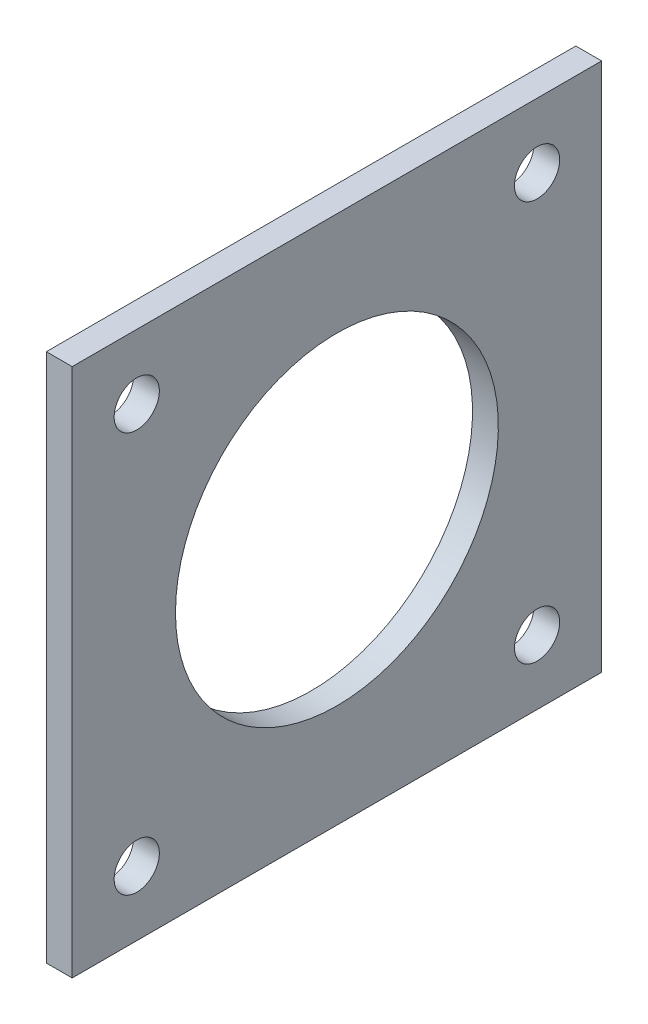
from build123d import *

# Parameters (mm, degrees)
BOSS_EXTRUDE2_DEPTH          = 8
BOSS_EXTRUDE2_DEPTH_BACK     = 1
SKETCH1_R                    = 2.5
CUT_EXTRUDE1_DEPTH           = 79.300702423
CUT_EXTRUDE1_DEPTH_BACK      = 79.300702423
SKETCH2_R                    = 2.5
SKETCH3_R                    = 3.25
CUT_EXTRUDE5_DEPTH           = 15
CUT_EXTRUDE5_DRAFT           = -0.0573
CUT_EXTRUDE5_PROFILE_2_DEPTH = 15
CUT_EXTRUDE5_PROFILE_2_DRAFT = -0.0573
SKETCH5_W                    = 4.5
SKETCH5_H                    = 6.5
BOSS_EXTRUDE3_DEPTH          = 14.5
SKETCH6_R                    = 4
CUT_EXTRUDE4_DEPTH           = 1.5
SKETCH12_W                   = 10.5
SKETCH12_H                   = 30
BOSS_EXTRUDE7_DEPTH          = 9
SKETCH15_W                   = 9
SKETCH15_H                   = 6.5
BOSS_EXTRUDE8_DEPTH          = 3.5
BOSS_EXTRUDE9_DEPTH          = 54
FILLET4_R                    = 5
SKETCH18_W                   = 9.873697418
SKETCH18_H                   = 6.5
BOSS_EXTRUDE11_DEPTH         = 0.5
SKETCH20_W                   = 4
SKETCH20_H                   = 17.5
BOSS_EXTRUDE12_DEPTH         = 18
BOSS_EXTRUDE13_DEPTH         = 11
BOSS_EXTRUDE13_DEPTH_BACK    = 4
SKETCH22_W                   = 17.5
SKETCH22_H                   = 4
SKETCH25_W                   = 2
SKETCH25_H                   = 17.5
BOSS_EXTRUDE14_DEPTH         = 41
SKETCH28_W                   = 41
SKETCH28_H                   = 45
BOSS_EXTRUDE15_DEPTH         = 2
SKETCH29_R                   = 1.75
CUT_EXTRUDE8_DEPTH           = 9
BOSS_EXTRUDE16_DEPTH         = 9
BOSS_EXTRUDE16_DEPTH_BACK    = 4
SKETCH30_W                   = 17.5
SKETCH30_H                   = 2
CUT_EXTRUDE9_DEPTH           = 9
SKETCH32_W                   = 13
SKETCH32_H                   = 4
BOSS_EXTRUDE17_DEPTH         = 23.5
SKETCH33_W                   = 0.5
SKETCH33_H                   = 17.5
BOSS_EXTRUDE18_DEPTH         = 20
SKETCH34_W                   = 4.5
SKETCH34_H                   = 25
SKETCH34_W_2                 = 15.5
SKETCH34_H_2                 = 4
SKETCH34_W_3                 = 9
BOSS_EXTRUDE19_DEPTH         = 26
SKETCH35_W                   = 9.873697418
SKETCH35_H                   = 0.5
BOSS_EXTRUDE20_DEPTH         = 47.5
BOSS_EXTRUDE21_DEPTH         = 47.5
SKETCH38_W                   = 0.419549816
SKETCH38_H                   = 18.5
CUT_EXTRUDE10_DEPTH          = 90.5
SKETCH39_W                   = 4
SKETCH39_H                   = 4
BOSS_EXTRUDE23_DEPTH         = 47.5
SKETCH46_W                   = 22.5
SKETCH46_H                   = 9
SKETCH46_W_2                 = 5
BOSS_EXTRUDE26_DEPTH         = 11.5
SKETCH47_W                   = 27.5
SKETCH47_H                   = 9
BOSS_EXTRUDE27_DEPTH         = 11
SKETCH48_W                   = 5
SKETCH48_H                   = 6.5
BOSS_EXTRUDE31_DEPTH         = 18.5
SKETCH50_R                   = 4
CUT_EXTRUDE11_DEPTH          = 1.5
SKETCH51_W                   = 9.626242636
SKETCH51_H                   = 9.125298808
BOSS_EXTRUDE32_DEPTH         = 1.5
BOSS_EXTRUDE35_DEPTH         = 47.5
SKETCH55_W                   = 9.873697418
SKETCH55_H                   = 0.5
CUT_EXTRUDE12_DEPTH          = 47.5
SKETCH56_W                   = 0.5
SKETCH56_H                   = 20
BOSS_EXTRUDE36_DEPTH         = 43.5
BOSS_EXTRUDE37_DEPTH         = 47.5
SKETCH58_W                   = 0.715052156
SKETCH58_H                   = 9.51279705
CUT_EXTRUDE13_DEPTH          = 4
CUT_EXTRUDE15_DEPTH          = 47.5
SKETCH60_W                   = 0.215052156
SKETCH60_H                   = 9.51279705
CUT_EXTRUDE16_DEPTH          = 47.5
CUT_EXTRUDE17_DEPTH          = 47.5
SKETCH62_W                   = 8
SKETCH62_H                   = 8
CUT_EXTRUDE18_DEPTH          = 47.5
SKETCH63_W                   = 13
SKETCH63_H                   = 4
CUT_EXTRUDE20_DEPTH          = 17
SKETCH64_W                   = 1
SKETCH64_H                   = 1.5
BOSS_EXTRUDE38_DEPTH         = 6.5
SKETCH65_W                   = 7
SKETCH65_H                   = 3
CUT_EXTRUDE21_DEPTH          = 1.5
BOSS_EXTRUDE39_START         = -2
BOSS_EXTRUDE39_DEPTH         = 2
CUT_EXTRUDE22_DEPTH          = 155
CUT_EXTRUDE23_DEPTH          = 97.458540317
CUT_EXTRUDE23_DEPTH_BACK     = 97.458540317
SKETCH69_W                   = 41
SKETCH69_H                   = 4
SKETCH69_W_2                 = 26
CUT_EXTRUDE24_DEPTH          = 95.562148876


with BuildPart() as part:
    # Sketch1 → Boss-Extrude2 (new, two sides: drawn at the far end of the back side and taken through both)
    with BuildSketch(Plane(origin=(0, 0, 0), x_dir=(1, 0, 0), z_dir=(0, 1, 0)).offset(-BOSS_EXTRUDE2_DEPTH_BACK)):
        with BuildLine():
            Line((5, 0), (50, 0))
            ThreePointArc((50, 0), (53.535533906, 1.464466094), (55, 5))
            Line((55, 5), (55, 50))
            ThreePointArc((55, 50), (53.535533906, 53.535533906), (50, 55))
            Line((50, 55), (5, 55))
            ThreePointArc((5, 55), (1.464466094, 53.535533906), (0, 50))
            Line((0, 50), (0, 5))
            ThreePointArc((0, 5), (1.464466094, 1.464466094), (5, 0))
        make_face()
        with Locations(Location((7.5, 47.5, 0), (0, 0, 270))):
            Circle(SKETCH1_R, mode=Mode.SUBTRACT)
        with Locations(Location((47.5, 47.5, 0), (0, 0, 270))):
            Circle(SKETCH1_R, mode=Mode.SUBTRACT)
        with Locations(Location((47.5, 7.5, 0), (0, 0, 270))):
            Circle(SKETCH1_R, mode=Mode.SUBTRACT)
        with Locations(Location((7.5, 7.5, 0), (0, 0, 270))):
            Circle(SKETCH1_R, mode=Mode.SUBTRACT)
    extrude(amount=BOSS_EXTRUDE2_DEPTH + BOSS_EXTRUDE2_DEPTH_BACK)

    # Sketch2 → Cut-Extrude1 (cut, two sides: drawn at the far end of the back side and taken through both)
    with BuildSketch(Plane(origin=(0, 8, 0), x_dir=(1, 0, 0), z_dir=(0, 1, 0)).offset(-CUT_EXTRUDE1_DEPTH_BACK)):
        with BuildLine():
            Line((0, 50), (0, 27.5))
            Line((0, 27.5), (55, 27.5))
            Line((55, 27.5), (55, 50))
            ThreePointArc((55, 50), (53.535533906, 53.535533906), (50, 55))
            Line((50, 55), (5, 55))
            ThreePointArc((5, 55), (1.464466094, 53.535533906), (0, 50))
        make_face()
        with Locations((7.5, 47.5)):
            Circle(SKETCH2_R, mode=Mode.SUBTRACT)
        with Locations((47.5, 47.5)):
            Circle(SKETCH2_R, mode=Mode.SUBTRACT)
    extrude(amount=CUT_EXTRUDE1_DEPTH + CUT_EXTRUDE1_DEPTH_BACK, mode=Mode.SUBTRACT)


with BuildPart() as cut_extrude5_tool:
    # Sketch3 → Cut-Extrude5 (with draft: the straight prism first)
    with BuildSketch(Plane(origin=(0, 0, -27.5), x_dir=(-1, 0, 0), z_dir=(0, 0, -1))):
        with Locations((-37.5, 3.5)):
            Circle(SKETCH3_R)
    extrude(amount=-CUT_EXTRUDE5_DEPTH)
    # Cut-Extrude5: the draft: its side faces are tilted about the plane it starts from
    cut_extrude5_sides = [cut_extrude5_tool.faces().sort_by_distance(p)[0] for p in [
        (40.75, 3.5, -20),
    ]]
    draft(cut_extrude5_sides, Plane(origin=(0, 0, -27.5), x_dir=(-1, 0, 0), z_dir=(0, 0, -1)), CUT_EXTRUDE5_DRAFT)


with BuildPart() as part_1:
    add(part.part)

    # Cut-Extrude5: cut by cut_extrude5_tool
    add(cut_extrude5_tool.part, mode=Mode.SUBTRACT)


with BuildPart() as cut_extrude5_profile_2_tool:
    # Sketch3 → Cut-Extrude5 profile 2 (with draft: the straight prism first)
    with BuildSketch(Plane(origin=(0, 0, -27.5), x_dir=(-1, 0, 0), z_dir=(0, 0, -1))):
        with Locations((-17.5, 3.5)):
            Circle(SKETCH3_R)
    extrude(amount=-CUT_EXTRUDE5_PROFILE_2_DEPTH)
    # Cut-Extrude5 profile 2: the draft: its side faces are tilted about the plane it starts from
    cut_extrude5_profile_2_sides = [cut_extrude5_profile_2_tool.faces().sort_by_distance(p)[0] for p in [
        (20.75, 3.5, -20),
    ]]
    draft(cut_extrude5_profile_2_sides, Plane(origin=(0, 0, -27.5), x_dir=(-1, 0, 0), z_dir=(0, 0, -1)), CUT_EXTRUDE5_PROFILE_2_DRAFT)


with BuildPart() as part_2:
    add(part_1.part)

    # Cut-Extrude5 profile 2: cut by cut_extrude5_profile_2_tool
    add(cut_extrude5_profile_2_tool.part, mode=Mode.SUBTRACT)

    # Sketch5 → Boss-Extrude3 (add)
    with BuildSketch(Plane(origin=(0, 8, 0), x_dir=(1, 0, 0), z_dir=(0, 1, 0))):
        with Locations((25.25, 20.75)):
            Rectangle(SKETCH5_W, SKETCH5_H)
        with Locations((29.75, 20.75)):
            Rectangle(SKETCH5_W, SKETCH5_H)
    extrude(amount=BOSS_EXTRUDE3_DEPTH)

    # Sketch6 → Cut-Extrude4 (cut)
    with BuildSketch(Plane(origin=(0, 0, -24), x_dir=(-1, 0, 0), z_dir=(0, 0, -1))):
        with Locations((-27.5, 17)):
            Circle(SKETCH6_R)
    extrude(amount=-CUT_EXTRUDE4_DEPTH, mode=Mode.SUBTRACT)

    # Sketch12 → Boss-Extrude7 (add)
    with BuildSketch(Plane(origin=(0, 8, 0), x_dir=(1, 0, 0), z_dir=(0, 1, 0))):
        with Locations((32.75, -15)):
            Rectangle(SKETCH12_W, SKETCH12_H)
        with Locations((22.25, -15)):
            Rectangle(SKETCH12_W, SKETCH12_H)
    extrude(amount=-BOSS_EXTRUDE7_DEPTH)

    # Sketch15 → Boss-Extrude8 (add)
    with BuildSketch(Plane(origin=(0, 22.5, 0), x_dir=(1, 0, 0), z_dir=(0, 1, 0))):
        with Locations((27.5, 20.75)):
            Rectangle(SKETCH15_W, SKETCH15_H)
    extrude(amount=BOSS_EXTRUDE8_DEPTH)

    # Sketch11 → Boss-Extrude9 (add)
    with BuildSketch(Plane(origin=(0, 0, -24), x_dir=(-1, 0, 0), z_dir=(0, 0, -1))):
        Polygon((-32.436848709, 26), (-29.5, 22.5), (-29.5, 26), align=None)
        Polygon((-29.5, 22.5), (-27.5, 22.5), (-25.5, 22.5), (-25.5, 26), (-29.5, 26), align=None)
        Polygon((-25.5, 26), (-25.5, 22.5), (-22.563151291, 26), align=None)
    extrude(amount=-BOSS_EXTRUDE9_DEPTH)

    # Fillet4
    fillet4_edges = [part_2.edges().sort_by_distance(p)[0] for p in [
        (27.5, -1, 30),
    ]]
    fillet(fillet4_edges, radius=FILLET4_R)

    # Sketch18 → Boss-Extrude11 (add)
    with BuildSketch(Plane(origin=(0, 26, 0), x_dir=(1, 0, 0), z_dir=(0, 1, 0))):
        with Locations((27.5, 20.75)):
            Rectangle(SKETCH18_W, SKETCH18_H)
    extrude(amount=BOSS_EXTRUDE11_DEPTH)

    # Sketch20 → Boss-Extrude12 (add)
    with BuildSketch(Plane(origin=(0, 8, 0), x_dir=(1, 0, 0), z_dir=(0, 1, 0))):
        with Locations((14.5, 8.75)):
            Rectangle(SKETCH20_W, SKETCH20_H)
        with Locations((40.5, 8.75)):
            Rectangle(SKETCH20_W, SKETCH20_H)
    extrude(amount=BOSS_EXTRUDE12_DEPTH)

    # Sketch22 → Boss-Extrude13 (add, two sides: drawn at the far end of the back side and taken through both)
    with BuildSketch(Plane.ZY.offset(-12.5).offset(-BOSS_EXTRUDE13_DEPTH_BACK)):
        with Locations((-8.75, 26)):
            Rectangle(SKETCH22_W, SKETCH22_H)
    extrude(amount=BOSS_EXTRUDE13_DEPTH + BOSS_EXTRUDE13_DEPTH_BACK)

    # Sketch25 → Boss-Extrude14 (add)
    with BuildSketch(Plane(origin=(0, 28, 0), x_dir=(1, 0, 0), z_dir=(0, 1, 0))):
        with Locations((2.5, 8.75)):
            Rectangle(SKETCH25_W, SKETCH25_H)
    extrude(amount=BOSS_EXTRUDE14_DEPTH)

    # Sketch28 → Boss-Extrude15 (add)
    with BuildSketch(Plane.ZY.offset(-1.5)):
        with Locations((-20.5, 46.5)):
            Rectangle(SKETCH28_W, SKETCH28_H)
    extrude(amount=-BOSS_EXTRUDE15_DEPTH)

    # Sketch29 → Cut-Extrude8 (cut)
    with BuildSketch(Plane.ZY.offset(-1.5)):
        with Locations((-36, 33)):
            Circle(SKETCH29_R)
        with Locations((-5, 64)):
            Circle(SKETCH29_R)
        with Locations((-5, 33)):
            Circle(SKETCH29_R)
        with Locations((-36, 64)):
            Circle(SKETCH29_R)
    extrude(amount=-CUT_EXTRUDE8_DEPTH, mode=Mode.SUBTRACT)

    # Sketch30 → Boss-Extrude16 (add, two sides: drawn at the far end of the back side and taken through both)
    with BuildSketch(Plane(origin=(42.5, 0, 0), x_dir=(0, 0, -1), z_dir=(1, 0, 0)).offset(-BOSS_EXTRUDE16_DEPTH_BACK)):
        with Locations((8.75, 25)):
            Rectangle(SKETCH30_W, SKETCH30_H)
        with Locations((8.75, 27)):
            Rectangle(SKETCH30_W, SKETCH30_H)
    extrude(amount=BOSS_EXTRUDE16_DEPTH + BOSS_EXTRUDE16_DEPTH_BACK)

    # Sketch31 → Cut-Extrude9 (cut)
    with BuildSketch(Plane(origin=(3.5, 0, 0), x_dir=(0, 0, -1), z_dir=(1, 0, 0))):
        with BuildLine():
            ThreePointArc((30.5, 47), (27.571067812, 54.071067812), (20.5, 57))
            Line((20.5, 57), (20.5, 47))
            Line((20.5, 47), (30.5, 47))
        make_face()
        with BuildLine():
            Line((20.5, 47), (20.5, 57))
            ThreePointArc((20.5, 57), (13.428932188, 39.928932188), (30.5, 47))
            Line((30.5, 47), (20.5, 47))
        make_face()
    extrude(amount=-CUT_EXTRUDE9_DEPTH, mode=Mode.SUBTRACT)

    # Sketch32 → Boss-Extrude17 (add)
    with BuildSketch(Plane(origin=(0, 0, -17.5), x_dir=(-1, 0, 0), z_dir=(0, 0, -1))):
        with Locations((-10, 26)):
            Rectangle(SKETCH32_W, SKETCH32_H)
    extrude(amount=BOSS_EXTRUDE17_DEPTH)

    # Sketch33 → Boss-Extrude18 (add)
    with BuildSketch(Plane(origin=(0, 8, 0), x_dir=(1, 0, 0), z_dir=(0, 1, 0))):
        with Locations((38.25, 8.75)):
            Rectangle(SKETCH33_W, SKETCH33_H)
        with Locations((16.75, 8.75)):
            Rectangle(SKETCH33_W, SKETCH33_H)
    extrude(amount=BOSS_EXTRUDE18_DEPTH)

    # Sketch34 → Boss-Extrude19 (add)
    with BuildSketch(Plane.XY):
        with Locations((14.75, 11.5)):
            Rectangle(SKETCH34_W, SKETCH34_H)
        with Locations((9.25, 26)):
            Rectangle(SKETCH34_W_2, SKETCH34_H_2)
        Polygon((42.5, 24), (42.5, 28), (38, 28), (38, 8), (38, -1), (42.5, -1), (42.5, 8), align=None)
        with Locations((47, 26)):
            Rectangle(SKETCH34_W_3, SKETCH34_H_2)
    extrude(amount=BOSS_EXTRUDE19_DEPTH)

    # Sketch35 → Boss-Extrude20 (add)
    with BuildSketch(Plane.XY.offset(-17.5)):
        with Locations((27.5, 26.25)):
            Rectangle(SKETCH35_W, SKETCH35_H)
    extrude(amount=BOSS_EXTRUDE20_DEPTH)

    # Sketch37 → Boss-Extrude21 (add)
    with BuildSketch(Plane.XY.offset(-17.5)):
        Polygon((23, 8), (25.5, 8), (25.5, 12), (23, 9.020616019), align=None)
        Polygon((25.5, 8), (27.5, 8), (29.5, 8), (29.5, 12), (25.5, 12), align=None)
        Polygon((29.5, 12), (29.5, 8), (32, 8), (32, 9.020616019), align=None)
        Polygon((29.5, 8), (27.5, 8), (25.5, 8), (23, 8), (23, 9.020616019), (21.863844179, 7.666598237), (33.136155821, 7.666598237), (32, 9.020616019), (32, 8), align=None)
    extrude(amount=BOSS_EXTRUDE21_DEPTH)

    # Sketch38 → Cut-Extrude10 (cut)
    with BuildSketch(Plane.XY.offset(30)):
        with Locations((22.353376383, 17.25)):
            Rectangle(SKETCH38_W, SKETCH38_H)
        with Locations((32.646623617, 17.25)):
            Rectangle(SKETCH38_W, SKETCH38_H)
    extrude(amount=-CUT_EXTRUDE10_DEPTH, mode=Mode.SUBTRACT)

    # Sketch39 → Boss-Extrude23 (add)
    with BuildSketch(Plane.XY.offset(30)):
        Polygon((21, 19.25), (17.715052156, 22.006398525), (17, 22.006398525), (17, 19.25), align=None)
        with Locations((19, 17.25)):
            Rectangle(SKETCH39_W, SKETCH39_H)
        Polygon((17.715052156, 12.493601475), (21, 15.25), (17, 15.25), (17, 12.493601475), align=None)
        Polygon((37.284947844, 12.493601475), (38, 12.493601475), (38, 15.25), (34, 15.25), align=None)
        Polygon((38, 17.25), (38, 19.25), (34, 19.25), (34, 15.25), (38, 15.25), align=None)
        Polygon((38, 19.25), (38, 22.006398525), (37.284947844, 22.006398525), (34, 19.25), align=None)
    extrude(amount=-BOSS_EXTRUDE23_DEPTH)

    # Sketch46 → Boss-Extrude26 (add)
    with BuildSketch(Plane.ZY):
        with Locations((-16.25, 3.5)):
            Rectangle(SKETCH46_W, SKETCH46_H)
        with Locations((-2.5, 3.5)):
            Rectangle(SKETCH46_W_2, SKETCH46_H)
    extrude(amount=-BOSS_EXTRUDE26_DEPTH)

    # Sketch47 → Boss-Extrude27 (add)
    with BuildSketch(Plane.ZY):
        with Locations((-13.75, 3.5)):
            Rectangle(SKETCH47_W, SKETCH47_H)
    extrude(amount=BOSS_EXTRUDE27_DEPTH)

    # Sketch48 → Boss-Extrude31 (add)
    with BuildSketch(Plane(origin=(0, 8, 0), x_dir=(1, 0, 0), z_dir=(0, 1, 0))):
        Polygon((42.5, 17.5), (42.5, 24), (32, 24), (32, 17.5), (32.436848709, 17.5), (38, 17.5), align=None)
        with Locations((45, 20.75)):
            Rectangle(SKETCH48_W, SKETCH48_H)
        Polygon((12.5, 24), (12.5, 17.5), (17, 17.5), (22.563151291, 17.5), (23, 17.5), (23, 24), align=None)
        with Locations((10, 20.75)):
            Rectangle(SKETCH48_W, SKETCH48_H)
    extrude(amount=BOSS_EXTRUDE31_DEPTH)

    # Sketch50 → Cut-Extrude11 (cut)
    with BuildSketch(Plane(origin=(0, 0, -24), x_dir=(-1, 0, 0), z_dir=(0, 0, -1))):
        with Locations((-17.5, 17)):
            Circle(SKETCH50_R)
        with Locations((-37.5, 17)):
            Circle(SKETCH50_R)
    extrude(amount=-CUT_EXTRUDE11_DEPTH, mode=Mode.SUBTRACT)

    # Sketch51 → Boss-Extrude32 (add)
    with BuildSketch(Plane(origin=(0, 0, -24), x_dir=(-1, 0, 0), z_dir=(0, 0, -1))):
        with Locations((-27.646184708, 17.114099589)):
            Rectangle(SKETCH51_W, SKETCH51_H)
    extrude(amount=-BOSS_EXTRUDE32_DEPTH)

    # Sketch54 → Boss-Extrude35 (add)
    with BuildSketch(Plane.XY.offset(-17.5)):
        Polygon((29.5, 22.5), (27.5, 22.5), (27.5, 14.5), (31.5, 14.5), (31.5, 22.5), align=None)
        Polygon((27.5, 14.5), (27.5, 22.5), (25.5, 22.5), (23.5, 22.5), (23.5, 14.5), align=None)
    extrude(amount=BOSS_EXTRUDE35_DEPTH)

    # Sketch55 → Cut-Extrude12 (cut)
    with BuildSketch(Plane.XY.offset(30)):
        with Locations((27.5, 26.25)):
            Rectangle(SKETCH55_W, SKETCH55_H)
    extrude(amount=-CUT_EXTRUDE12_DEPTH, mode=Mode.SUBTRACT)

    # Sketch56 → Boss-Extrude36 (add)
    with BuildSketch(Plane.XY.offset(26)):
        with Locations((37.75, 18)):
            Rectangle(SKETCH56_W, SKETCH56_H)
        with Locations((17.25, 18)):
            Rectangle(SKETCH56_W, SKETCH56_H)
    extrude(amount=-BOSS_EXTRUDE36_DEPTH)

    # Sketch57 → Boss-Extrude37 (add)
    with BuildSketch(Plane.XY.offset(30)):
        Polygon((35, 23.436848709), (31.5, 20.5), (31.5, 20.428787517), (35, 20.428787517), align=None)
        Polygon((35, 20.428787517), (31.5, 20.428787517), (31.5, 18.5), (35, 18.5), (35, 18.535606241), align=None)
        Polygon((35, 18.5), (31.5, 18.5), (31.5, 16.5), (35, 16.5), (35, 18.464393759), align=None)
        Polygon((35, 16.5), (31.5, 16.5), (35, 13.563151291), align=None)
        Polygon((32.436848709, 11), (29.5, 14.5), (25.5, 14.5), (22.563151291, 11), align=None)
        Polygon((20, 16.5), (23.5, 16.5), (23.5, 18.5), (23.5, 20.5), (20, 23.436848709), (20, 18.535606241), (20, 18.464393759), align=None)
        Polygon((20, 13.563151291), (23.5, 16.5), (20, 16.5), align=None)
    extrude(amount=-BOSS_EXTRUDE37_DEPTH)

    # Sketch58 → Cut-Extrude13 (cut)
    with BuildSketch(Plane.XY.offset(30)):
        with Locations((37.642473922, 17.25)):
            Rectangle(SKETCH58_W, SKETCH58_H)
        with Locations((17.357526078, 17.25)):
            Rectangle(SKETCH58_W, SKETCH58_H)
    extrude(amount=-CUT_EXTRUDE13_DEPTH, mode=Mode.SUBTRACT)

    # Sketch59 → Cut-Extrude15 (cut)
    with BuildSketch(Plane.XY.offset(30)):
        Polygon((37.284947844, 22.006398525), (35, 20.089099631), (35, 14.410900369), (37.284947844, 12.493601475), align=None)
        Polygon((17.715052156, 22.006398525), (20, 20.089099631), (20, 14.410900369), (17.715052156, 12.493601475), align=None)
    extrude(amount=-CUT_EXTRUDE15_DEPTH, mode=Mode.SUBTRACT)

    # Sketch60 → Cut-Extrude16 (cut)
    with BuildSketch(Plane.XY.offset(26)):
        with Locations((37.392473922, 17.25)):
            Rectangle(SKETCH60_W, SKETCH60_H)
        with Locations((17.607526078, 17.25)):
            Rectangle(SKETCH60_W, SKETCH60_H)
    extrude(amount=-CUT_EXTRUDE16_DEPTH, mode=Mode.SUBTRACT)

    # Sketch61 → Cut-Extrude17 (cut)
    with BuildSketch(Plane.XY.offset(30)):
        Polygon((32.436848709, 8), (22.563151291, 8), (22.563151291, 8.5), (24.660900369, 11), (30.339099631, 11), (32.436848709, 8.5), align=None)
    extrude(amount=-CUT_EXTRUDE17_DEPTH, mode=Mode.SUBTRACT)

    # Sketch62 → Cut-Extrude18 (cut)
    with BuildSketch(Plane.XY.offset(30)):
        with Locations((27.5, 18.5)):
            Rectangle(SKETCH62_W, SKETCH62_H)
    extrude(amount=-CUT_EXTRUDE18_DEPTH, mode=Mode.SUBTRACT)

    # Sketch63 → Cut-Extrude20 (cut)
    with BuildSketch(Plane(origin=(0, 0, -41), x_dir=(-1, 0, 0), z_dir=(0, 0, -1))):
        with Locations((-10, 26)):
            Rectangle(SKETCH63_W, SKETCH63_H)
    extrude(amount=-CUT_EXTRUDE20_DEPTH, mode=Mode.SUBTRACT)

    # Sketch64 → Boss-Extrude38 (add)
    with BuildSketch(Plane(origin=(0, 0, -17.5), x_dir=(-1, 0, 0), z_dir=(0, 0, -1))):
        with Locations((-17, 27.25)):
            Rectangle(SKETCH64_W, SKETCH64_H)
    extrude(amount=BOSS_EXTRUDE38_DEPTH)

    # Sketch65 → Cut-Extrude21 (cut)
    with BuildSketch(Plane(origin=(0, 28, 0), x_dir=(1, 0, 0), z_dir=(0, 1, 0))):
        with Locations((48, 16)):
            Rectangle(SKETCH65_W, SKETCH65_H)
    extrude(amount=-CUT_EXTRUDE21_DEPTH, mode=Mode.SUBTRACT)

    # Sketch66 → Boss-Extrude39 (add)
    with BuildSketch(Plane.ZY.offset(-1.5).offset(BOSS_EXTRUDE39_START)):
        with BuildLine():
            ThreePointArc((-30.5, 47), (-20.5, 37), (-10.5, 47))
            Line((-10.5, 47), (-30.5, 47))
        make_face()
        with BuildLine():
            Line((-30.5, 47), (-10.5, 47))
            ThreePointArc((-10.5, 47), (-20.5, 57), (-30.5, 47))
        make_face()
    extrude(amount=BOSS_EXTRUDE39_DEPTH)

    # Sketch67 → Cut-Extrude22 (cut)
    with BuildSketch(Plane.ZY.offset(-1.5)):
        with BuildLine():
            ThreePointArc((-33, 48.5), (-29.338834765, 39.661165235), (-20.5, 36))
            Line((-20.5, 36), (-20.5, 48.5))
            Line((-20.5, 48.5), (-33, 48.5))
        make_face()
        with BuildLine():
            Line((-20.5, 48.5), (-20.5, 36))
            ThreePointArc((-20.5, 36), (-11.661165235, 39.661165235), (-8, 48.5))
            Line((-8, 48.5), (-20.5, 48.5))
        make_face()
        with BuildLine():
            Line((-33, 48.5), (-20.5, 48.5))
            Line((-20.5, 48.5), (-20.5, 61))
            ThreePointArc((-20.5, 61), (-29.338834765, 57.338834765), (-33, 48.5))
        make_face()
        with BuildLine():
            Line((-20.5, 61), (-20.5, 48.5))
            Line((-20.5, 48.5), (-8, 48.5))
            ThreePointArc((-8, 48.5), (-11.661165235, 57.338834765), (-20.5, 61))
        make_face()
    extrude(amount=-CUT_EXTRUDE22_DEPTH, mode=Mode.SUBTRACT)

    # Sketch68 → Cut-Extrude23 (cut, two sides: drawn at the far end of the back side and taken through both)
    with BuildSketch(Plane.ZY.offset(-1.5).offset(-CUT_EXTRUDE23_DEPTH_BACK)):
        Polygon((26, 24), (0, 24), (-41, 24), (-41, -3.723852661), (62.997520678, -3.723852661), (62.997520678, 28), (26, 28), align=None)
    extrude(amount=CUT_EXTRUDE23_DEPTH + CUT_EXTRUDE23_DEPTH_BACK, mode=Mode.SUBTRACT)

    # Sketch69 → Cut-Extrude24 (cut, through all)
    with BuildSketch(Plane.ZY.offset(-1.5)):
        with Locations((-20.5, 26)):
            Rectangle(SKETCH69_W, SKETCH69_H)
        with Locations((13, 26)):
            Rectangle(SKETCH69_W_2, SKETCH69_H)
    extrude(amount=-CUT_EXTRUDE24_DEPTH, mode=Mode.SUBTRACT)


solid = part_2.part
